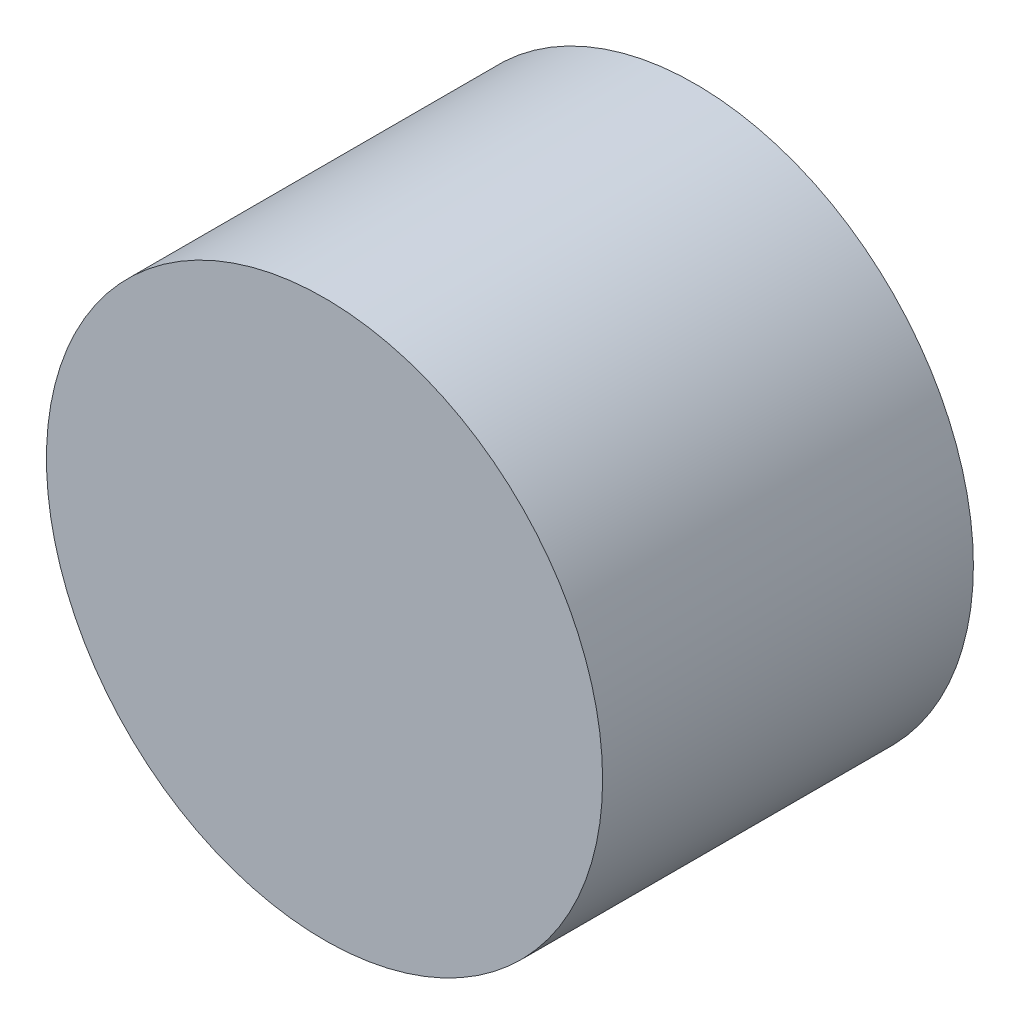
from build123d import *

# Parameters (mm, degrees)
SKETCH2_R           = 7.5
BOSS_EXTRUDE1_DEPTH = 10
SKETCH3_R           = 3
CUT_EXTRUDE1_DEPTH  = 9.8


with BuildPart() as part:
    # Sketch2 → Boss-Extrude1 (new body)
    with BuildSketch(Plane.XY):
        Circle(SKETCH2_R)
    extrude(amount=BOSS_EXTRUDE1_DEPTH)

    # Sketch3 → Cut-Extrude1 (cut)
    with BuildSketch(Plane(origin=(0, 0, 0), x_dir=(-1, 0, 0), z_dir=(0, 0, -1))):
        Circle(SKETCH3_R)
    extrude(amount=-CUT_EXTRUDE1_DEPTH, mode=Mode.SUBTRACT)


solid = part.part
